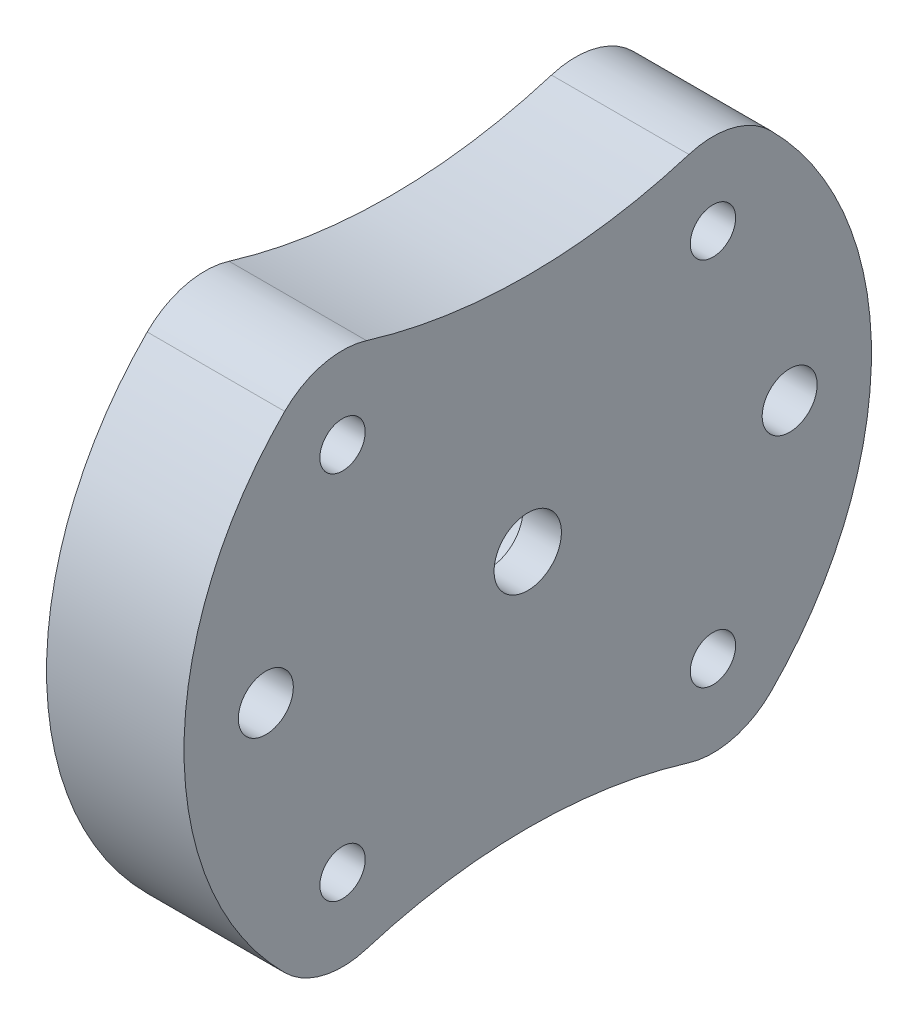
from build123d import *

# Parameters (mm, degrees)
SKETCH_1_R          = 25
EXTRUDE_1_DEPTH     = 10
SKETCH_3_R          = 2.45
CUT_EXTRUDE_1_DEPTH = 37.742346142
SKETCH_5_R          = 4.95
CUT_EXTRUDE_2_DEPTH = 7.2
SKETCH_6_R          = 2
CUT_EXTRUDE_3_DEPTH = 37.742346142
SKETCH_7_R          = 1.65
CUT_EXTRUDE_4_DEPTH = 37.742346142
CUT_EXTRUDE_5_DEPTH = 37.742346142


with BuildPart() as part:
    # ｽｹｯﾁ1 → ﾎﾞｽ - 押し出し1 (new body)
    with BuildSketch(Plane(origin=(0, 0, 0), x_dir=(0, 0, -1), z_dir=(1, 0, 0))):
        Circle(SKETCH_1_R)
    extrude(amount=EXTRUDE_1_DEPTH)

    # ｽｹｯﾁ3 → ｶｯﾄ - 押し出し1 (cut, through all)
    with BuildSketch(Plane(origin=(10, 0, 0), x_dir=(0, 0, -1), z_dir=(1, 0, 0))):
        Circle(SKETCH_3_R)
    extrude(amount=-CUT_EXTRUDE_1_DEPTH, mode=Mode.SUBTRACT)

    # ｽｹｯﾁ5 → ｶｯﾄ - 押し出し2 (cut)
    with BuildSketch(Plane.ZY):
        Circle(SKETCH_5_R)
    extrude(amount=-CUT_EXTRUDE_2_DEPTH, mode=Mode.SUBTRACT)

    # ｽｹｯﾁ6 → ｶｯﾄ - 押し出し3 (cut, through all)
    with BuildSketch(Plane(origin=(10, 0, 0), x_dir=(0, 0, -1), z_dir=(1, 0, 0))):
        with Locations((-19.05, 0)):
            Circle(SKETCH_6_R)
        with Locations(Location((19.05, 0, 0), (0, 0, 180))):
            Circle(SKETCH_6_R)
    extrude(amount=-CUT_EXTRUDE_3_DEPTH, mode=Mode.SUBTRACT)

    # ｽｹｯﾁ7 → ｶｯﾄ - 押し出し4 (cut, through all)
    with BuildSketch(Plane(origin=(10, 0, 0), x_dir=(0, 0, -1), z_dir=(1, 0, 0))):
        with Locations((13.470384182, 13.470384182)):
            Circle(SKETCH_7_R)
        with Locations((13.470384182, -13.470384182)):
            Circle(SKETCH_7_R)
        with Locations((-13.470384182, -13.470384182)):
            Circle(SKETCH_7_R)
        with Locations((-13.470384182, 13.470384182)):
            Circle(SKETCH_7_R)
    extrude(amount=-CUT_EXTRUDE_4_DEPTH, mode=Mode.SUBTRACT)

    # ｽｹｯﾁ8 → ｶｯﾄ - 押し出し5 (cut, through all)
    with BuildSketch(Plane(origin=(10, 0, 0), x_dir=(0, 0, -1), z_dir=(1, 0, 0))):
        with BuildLine():
            ThreePointArc((-17.67766953, 17.67766953), (-14.907460792, 19.244231323), (-11.726124041, 19.158974214))
            ThreePointArc((-11.726124041, 19.158974214), (-3.5e-08, 17.401594613), (11.726123974, 19.158974194))
            ThreePointArc((11.726123974, 19.158974194), (14.907460759, 19.244231332), (17.67766953, 17.67766953))
            ThreePointArc((17.67766953, 17.67766953), (0, 25), (-17.67766953, 17.67766953))
        make_face()
        with BuildLine():
            ThreePointArc((-11.726124073, -19.158974224), (-14.90746082, -19.244231316), (-17.677669546, -17.677669513))
            ThreePointArc((-17.677669546, -17.677669513), (-4.3e-08, -25), (17.677669486, -17.677669573))
            ThreePointArc((17.677669486, -17.677669573), (14.9074607, -19.244231346), (11.726123917, -19.158974177))
            ThreePointArc((11.726123917, -19.158974177), (-8.1e-08, -17.401594613), (-11.726124073, -19.158974224))
        make_face()
    extrude(amount=-CUT_EXTRUDE_5_DEPTH, mode=Mode.SUBTRACT)


solid = part.part
